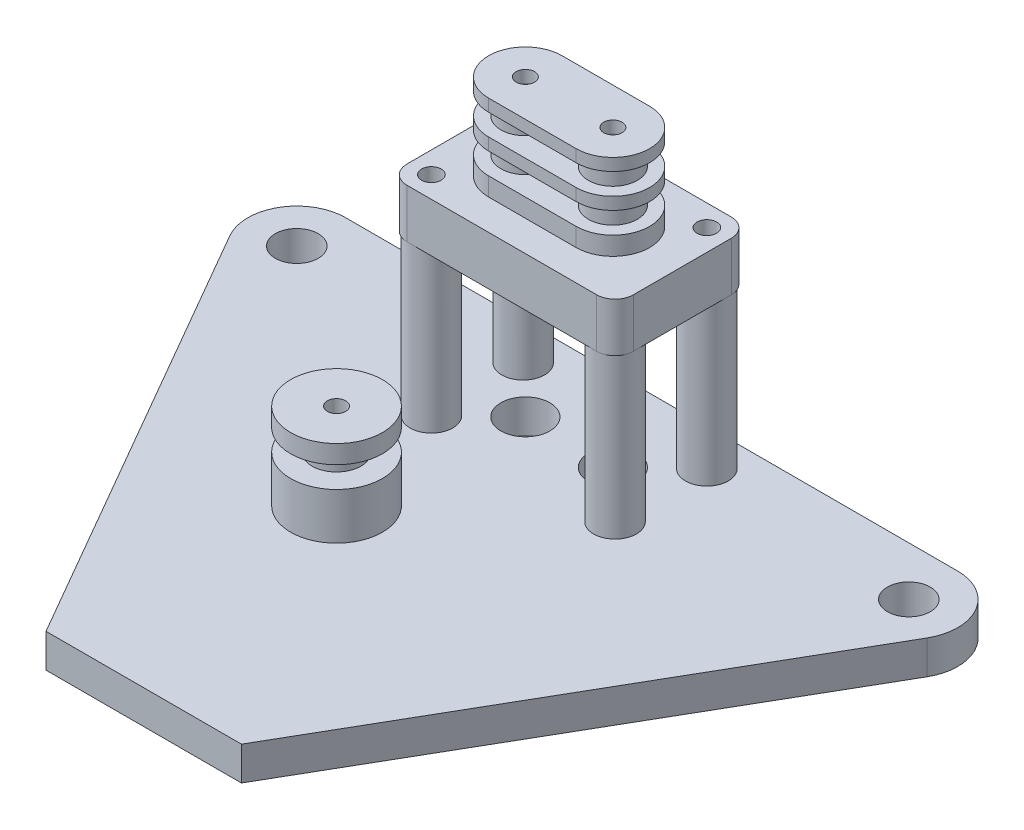
from build123d import *

# Parameters (mm, degrees)
SKETCH_1_R             = 3.5
SKETCH_1_R_2           = 4
SKETCH_1_R_3           = 1.5
EXTRUDE_1_DEPTH        = 5.5
SKETCH_3_R             = 7.5
SKETCH_3_R_2           = 1.5
EXTRUDE_2_DEPTH        = 7.6
SKETCH_4_R             = 3
SKETCH_4_R_2           = 1.5
EXTRUDE_3_DEPTH        = 3.5
SKETCH_5_R             = 4
SKETCH_5_R_2           = 3.1
EXTRUDE_4_DEPTH        = 3
SKETCH_6_R             = 7.5
SKETCH_6_R_2           = 1.5
EXTRUDE_5_DEPTH        = 3
SKETCH_7_R             = 3.5
SKETCH_7_R_2           = 1.6
EXTRUDE_6_DEPTH        = 26.1
EXTRUDE_6_2_DEPTH      = 26.1
EXTRUDE_6_3_DEPTH      = 26.1
EXTRUDE_6_4_DEPTH      = 26.1
SKETCH_8_R             = 1.6
CUT_EXTRUDE_1_DEPTH    = 76.943795007
EXTRUDE_START          = 8
SKETCH_9_R             = 1.6
SKETCH_9_R_2           = 1.5
EXTRUDE_7_DEPTH        = 8
SKETCH_10_R            = 1.5
EXTRUDE_9_DEPTH        = 3
SKETCH_11_R            = 2.5
SKETCH_11_R_2          = 1.5
EXTRUDE_10_DEPTH       = 3.5
EXTRUDE_10_2_DEPTH     = 3.5
SKETCH_12_R            = 4
SKETCH_12_R_2          = 2.6
EXTRUDE_11_DEPTH       = 3
EXTRUDE_11_2_DEPTH     = 3
SKETCH_13_R            = 1.5
EXTRUDE_12_DEPTH       = 2
PATTERN_LINEAR_1_COUNT = 2
PATTERN_LINEAR_1_PITCH = 5.5


with BuildPart() as part:
    # ｽｹｯﾁ1 → ﾎﾞｽ - 押し出し1 (new body)
    with BuildSketch(Plane(origin=(0, 0, 0), x_dir=(1, 0, 0), z_dir=(0, 1, 0))):
        with BuildLine():
            Line((-56.929473998, 29.502201843), (-15.966412191, -41.5))
            Line((-15.966412191, -41.5), (15.966412191, -41.5))
            Line((15.966412191, -41.5), (56.929473998, 29.502201843))
            ThreePointArc((56.929473998, 29.502201843), (56.927567584, 37.50110077), (50, 41.5))
            Line((50, 41.5), (-50, 41.5))
            ThreePointArc((-50, 41.5), (-56.927567584, 37.50110077), (-56.929473998, 29.502201843))
        make_face()
        with Locations(Location((-50, 33.5, 0), (0, 0, 270))):
            Circle(SKETCH_1_R, mode=Mode.SUBTRACT)
        with Locations(Location((50, 33.5, 0), (0, 0, 90))):
            Circle(SKETCH_1_R, mode=Mode.SUBTRACT)
        with Locations(Location((-7.15, 28, 0), (0, 0, 270))):
            Circle(SKETCH_1_R_2, mode=Mode.SUBTRACT)
        with Locations(Location((7.15, 28, 0), (0, 0, 90))):
            Circle(SKETCH_1_R_2, mode=Mode.SUBTRACT)
        with Locations(Location((-10, 0, 0), (0, 0, 270))):
            Circle(SKETCH_1_R_3, mode=Mode.SUBTRACT)
    extrude(amount=EXTRUDE_1_DEPTH)

    # ｽｹｯﾁ8 → ｶｯﾄ - 押し出し1 (cut, through all)
    with BuildSketch(Plane(origin=(0, 5.5, 0), x_dir=(1, 0, 0), z_dir=(0, 1, 0))):
        with Locations(Location((15, 35.5, 0), (0, 0, 270))):
            Circle(SKETCH_8_R)
        with Locations(Location((-15, 20.5, 0), (0, 0, 270))):
            Circle(SKETCH_8_R)
        with Locations(Location((-15, 35.5, 0), (0, 0, 270))):
            Circle(SKETCH_8_R)
        with Locations(Location((15, 20.5, 0), (0, 0, 270))):
            Circle(SKETCH_8_R)
    extrude(amount=-CUT_EXTRUDE_1_DEPTH, mode=Mode.SUBTRACT)


with BuildPart() as body_2:
    # ｽｹｯﾁ3 → ﾎﾞｽ - 押し出し2 (new body)
    with BuildSketch(Plane(origin=(0, 5.5, 0), x_dir=(1, 0, 0), z_dir=(0, 1, 0))):
        with Locations(Location((-10, 0, 0), (0, 0, 90))):
            Circle(SKETCH_3_R)
        with Locations(Location((-10, 0, 0), (0, 0, 90))):
            Circle(SKETCH_3_R_2, mode=Mode.SUBTRACT)
    extrude(amount=EXTRUDE_2_DEPTH)


with BuildPart() as body_3:
    # ｽｹｯﾁ4 → ﾎﾞｽ - 押し出し3 (new body)
    with BuildSketch(Plane(origin=(0, 13.1, 0), x_dir=(1, 0, 0), z_dir=(0, 1, 0))):
        with Locations(Location((-10, 0, 0), (0, 0, 270))):
            Circle(SKETCH_4_R)
        with Locations(Location((-10, 0, 0), (0, 0, 270))):
            Circle(SKETCH_4_R_2, mode=Mode.SUBTRACT)
    extrude(amount=EXTRUDE_3_DEPTH)


with BuildPart() as body_4:
    # ｽｹｯﾁ5 → ﾎﾞｽ - 押し出し4 (new body)
    with BuildSketch(Plane(origin=(0, 13.1, 0), x_dir=(1, 0, 0), z_dir=(0, 1, 0))):
        with Locations(Location((-10, 0, 0), (0, 0, 270))):
            Circle(SKETCH_5_R)
        with Locations(Location((-10, 0, 0), (0, 0, 270))):
            Circle(SKETCH_5_R_2, mode=Mode.SUBTRACT)
    extrude(amount=EXTRUDE_4_DEPTH)


with BuildPart() as body_5:
    # ｽｹｯﾁ6 → ﾎﾞｽ - 押し出し5 (new body)
    with BuildSketch(Plane(origin=(0, 16.6, 0), x_dir=(1, 0, 0), z_dir=(0, 1, 0))):
        with Locations(Location((-10, 0, 0), (0, 0, 270))):
            Circle(SKETCH_6_R)
        with Locations(Location((-10, 0, 0), (0, 0, 270))):
            Circle(SKETCH_6_R_2, mode=Mode.SUBTRACT)
    extrude(amount=EXTRUDE_5_DEPTH)


with BuildPart() as body_6:
    # ｽｹｯﾁ7 → ﾎﾞｽ - 押し出し6 (new body)
    with BuildSketch(Plane(origin=(0, 5.5, 0), x_dir=(1, 0, 0), z_dir=(0, 1, 0))):
        with Locations(Location((-15, 35.5, 0), (0, 0, 270))):
            Circle(SKETCH_7_R)
        with Locations(Location((-15, 35.5, 0), (0, 0, 270))):
            Circle(SKETCH_7_R_2, mode=Mode.SUBTRACT)
    extrude(amount=EXTRUDE_6_DEPTH)



with BuildPart() as body_7:
    # ｽｹｯﾁ7 → Extrude 6 2 (new body)
    with BuildSketch(Plane(origin=(0, 5.5, 0), x_dir=(1, 0, 0), z_dir=(0, 1, 0))):
        with Locations(Location((-15, 20.5, 0), (0, 0, 270))):
            Circle(SKETCH_7_R)
        with Locations(Location((-15, 20.5, 0), (0, 0, 270))):
            Circle(SKETCH_7_R_2, mode=Mode.SUBTRACT)
    extrude(amount=EXTRUDE_6_2_DEPTH)


with BuildPart() as body_8:
    # ｽｹｯﾁ7 → Extrude 6 3 (new body)
    with BuildSketch(Plane(origin=(0, 5.5, 0), x_dir=(1, 0, 0), z_dir=(0, 1, 0))):
        with Locations(Location((15, 35.5, 0), (0, 0, 270))):
            Circle(SKETCH_7_R)
        with Locations(Location((15, 35.5, 0), (0, 0, 270))):
            Circle(SKETCH_7_R_2, mode=Mode.SUBTRACT)
    extrude(amount=EXTRUDE_6_3_DEPTH)


with BuildPart() as body_9:
    # ｽｹｯﾁ7 → Extrude 6 4 (new body)
    with BuildSketch(Plane(origin=(0, 5.5, 0), x_dir=(1, 0, 0), z_dir=(0, 1, 0))):
        with Locations(Location((15, 20.5, 0), (0, 0, 270))):
            Circle(SKETCH_7_R)
        with Locations(Location((15, 20.5, 0), (0, 0, 270))):
            Circle(SKETCH_7_R_2, mode=Mode.SUBTRACT)
    extrude(amount=EXTRUDE_6_4_DEPTH)


with BuildPart() as body_6_1:
    add(body_6.part)

    add(body_7.part)  # ﾎﾞｽ - 押し出し7 merges body 7

    add(body_8.part)  # ﾎﾞｽ - 押し出し7 merges body 8

    add(body_9.part)  # ﾎﾞｽ - 押し出し7 merges body 9
    # ｽｹｯﾁ9 → ﾎﾞｽ - 押し出し7 (add)
    with BuildSketch(Plane(origin=(0, 31.6, 0), x_dir=(1, 0, 0), z_dir=(0, 1, 0)).offset(EXTRUDE_START)):
        with BuildLine():
            Line((15.5, 17), (-15.5, 17))
            ThreePointArc((-15.5, 17), (-17.621320344, 17.878679656), (-18.5, 20))
            Line((-18.5, 20), (-18.5, 36))
            ThreePointArc((-18.5, 36), (-17.621320344, 38.121320344), (-15.5, 39))
            Line((-15.5, 39), (15.5, 39))
            ThreePointArc((15.5, 39), (17.621320344, 38.121320344), (18.5, 36))
            Line((18.5, 36), (18.5, 20))
            ThreePointArc((18.5, 20), (17.621320344, 17.878679656), (15.5, 17))
        make_face()
        with Locations(Location((15, 35.5, 0), (0, 0, 270))):
            Circle(SKETCH_9_R, mode=Mode.SUBTRACT)
        with Locations(Location((-15, 20.5, 0), (0, 0, 270))):
            Circle(SKETCH_9_R, mode=Mode.SUBTRACT)
        with Locations(Location((-15, 35.5, 0), (0, 0, 270))):
            Circle(SKETCH_9_R, mode=Mode.SUBTRACT)
        with Locations(Location((7.15, 28, 0), (0, 0, 270))):
            Circle(SKETCH_9_R_2, mode=Mode.SUBTRACT)
        with Locations(Location((-7.15, 28, 0), (0, 0, 270))):
            Circle(SKETCH_9_R_2, mode=Mode.SUBTRACT)
    extrude(amount=-EXTRUDE_7_DEPTH)


with BuildPart() as body_7_2:
    # ｽｹｯﾁ10 → ﾎﾞｽ - 押し出し9 (new body)
    with BuildSketch(Plane(origin=(0, 39.6, 0), x_dir=(1, 0, 0), z_dir=(0, 1, 0))):
        with BuildLine():
            Line((-7.15, 34), (7.15, 34))
            ThreePointArc((7.15, 34), (13.15, 28), (7.15, 22))
            Line((7.15, 22), (-7.15, 22))
            ThreePointArc((-7.15, 22), (-13.15, 28), (-7.15, 34))
        make_face()
        with Locations(Location((7.15, 28, 0), (0, 0, 270))):
            Circle(SKETCH_10_R, mode=Mode.SUBTRACT)
        with Locations(Location((-7.15, 28, 0), (0, 0, 270))):
            Circle(SKETCH_10_R, mode=Mode.SUBTRACT)
    extrude(amount=EXTRUDE_9_DEPTH)


with BuildPart() as body_8_2:
    # ｽｹｯﾁ11 → ﾎﾞｽ - 押し出し10 (new body)
    with BuildSketch(Plane(origin=(0, 42.6, 0), x_dir=(1, 0, 0), z_dir=(0, 1, 0))):
        with Locations(Location((-7.15, 28, 0), (0, 0, 270))):
            Circle(SKETCH_11_R)
        with Locations(Location((-7.15, 28, 0), (0, 0, 270))):
            Circle(SKETCH_11_R_2, mode=Mode.SUBTRACT)
    extrude(amount=EXTRUDE_10_DEPTH)


with BuildPart() as body_9_2:
    # ｽｹｯﾁ11 → Extrude 10 2 (new body)
    with BuildSketch(Plane(origin=(0, 42.6, 0), x_dir=(1, 0, 0), z_dir=(0, 1, 0))):
        with Locations(Location((7.15, 28, 0), (0, 0, 270))):
            Circle(SKETCH_11_R)
        with Locations(Location((7.15, 28, 0), (0, 0, 270))):
            Circle(SKETCH_11_R_2, mode=Mode.SUBTRACT)
    extrude(amount=EXTRUDE_10_2_DEPTH)


with BuildPart() as body_10:
    # ｽｹｯﾁ12 → ﾎﾞｽ - 押し出し11 (new body)
    with BuildSketch(Plane(origin=(0, 42.6, 0), x_dir=(1, 0, 0), z_dir=(0, 1, 0))):
        with Locations(Location((-7.15, 28, 0), (0, 0, 270))):
            Circle(SKETCH_12_R)
        with Locations(Location((-7.15, 28, 0), (0, 0, 270))):
            Circle(SKETCH_12_R_2, mode=Mode.SUBTRACT)
    extrude(amount=EXTRUDE_11_DEPTH)


with BuildPart() as body_11:
    # ｽｹｯﾁ12 → Extrude 11 2 (new body)
    with BuildSketch(Plane(origin=(0, 42.6, 0), x_dir=(1, 0, 0), z_dir=(0, 1, 0))):
        with Locations(Location((7.15, 28, 0), (0, 0, 270))):
            Circle(SKETCH_12_R)
        with Locations(Location((7.15, 28, 0), (0, 0, 270))):
            Circle(SKETCH_12_R_2, mode=Mode.SUBTRACT)
    extrude(amount=EXTRUDE_11_2_DEPTH)


with BuildPart() as body_12:
    # ｽｹｯﾁ13 → ﾎﾞｽ - 押し出し12 (new body)
    with BuildSketch(Plane(origin=(0, 46.1, 0), x_dir=(1, 0, 0), z_dir=(0, 1, 0))):
        with BuildLine():
            Line((-7.15, 22), (7.15, 22))
            ThreePointArc((7.15, 22), (13.15, 28), (7.15, 34))
            Line((7.15, 34), (-7.15, 34))
            ThreePointArc((-7.15, 34), (-13.15, 28), (-7.15, 22))
        make_face()
        with Locations(Location((7.15, 28, 0), (0, 0, 270))):
            Circle(SKETCH_13_R, mode=Mode.SUBTRACT)
        with Locations(Location((-7.15, 28, 0), (0, 0, 270))):
            Circle(SKETCH_13_R, mode=Mode.SUBTRACT)
    extrude(amount=EXTRUDE_12_DEPTH)


with BuildPart() as pattern_linear_1_1:
    # 直線ﾊﾟﾀｰﾝ1: pattern copy
    add(body_12.part.moved(Location(Vector(0, 1, 0) * (1 * PATTERN_LINEAR_1_PITCH))))


with BuildPart() as pattern_linear_1_2:
    # 直線ﾊﾟﾀｰﾝ1: pattern copy
    add(body_11.part.moved(Location(Vector(0, 1, 0) * (1 * PATTERN_LINEAR_1_PITCH))))


with BuildPart() as pattern_linear_1_3:
    # 直線ﾊﾟﾀｰﾝ1: pattern copy
    add(body_10.part.moved(Location(Vector(0, 1, 0) * (1 * PATTERN_LINEAR_1_PITCH))))


with BuildPart() as pattern_linear_1_4:
    # 直線ﾊﾟﾀｰﾝ1: pattern copy
    add(body_8_2.part.moved(Location(Vector(0, 1, 0) * (1 * PATTERN_LINEAR_1_PITCH))))


with BuildPart() as pattern_linear_1_5:
    # 直線ﾊﾟﾀｰﾝ1: pattern copy
    add(body_9_2.part.moved(Location(Vector(0, 1, 0) * (1 * PATTERN_LINEAR_1_PITCH))))


solid = Compound([part.part, body_2.part, body_3.part, body_4.part, body_5.part, body_6_1.part, body_7_2.part, body_8_2.part, body_9_2.part, body_10.part, body_11.part, body_12.part, pattern_linear_1_1.part, pattern_linear_1_2.part, pattern_linear_1_3.part, pattern_linear_1_4.part, pattern_linear_1_5.part])
